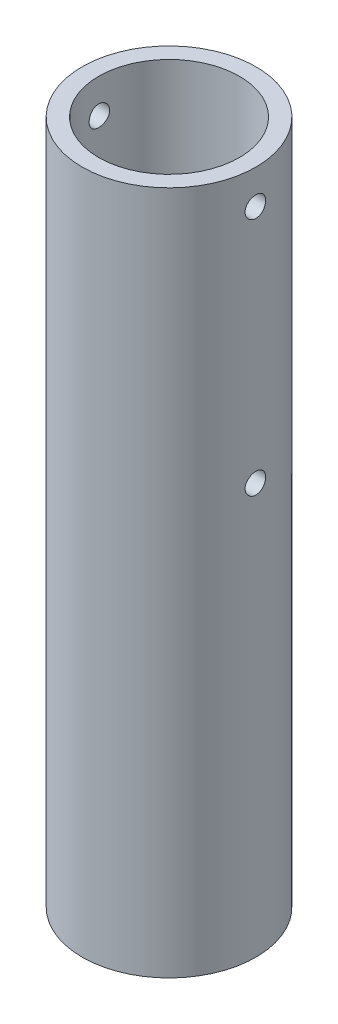
from build123d import *

# Parameters (mm, degrees)
SKETCH1_R               = 12.7
SKETCH1_R_2             = 10.287
BOSS_EXTRUDE1_DEPTH     = 100
CUT_EXTRUDE1_DEPTH      = 20
CUT_EXTRUDE1_DEPTH_BACK = 20
SKETCH2_R               = 1.5


with BuildPart() as part:
    # Sketch1 → Boss-Extrude1 (new body)
    with BuildSketch(Plane(origin=(0, 0, 0), x_dir=(1, 0, 0), z_dir=(0, 1, 0))):
        Circle(SKETCH1_R)
        Circle(SKETCH1_R_2, mode=Mode.SUBTRACT)
    extrude(amount=BOSS_EXTRUDE1_DEPTH)

    # Sketch2 → Cut-Extrude1 (cut, two sides: drawn at the far end of the back side and taken through both)
    with BuildSketch(Plane(origin=(0, 0, 0), x_dir=(0, 0, -1), z_dir=(1, 0, 0)).offset(-CUT_EXTRUDE1_DEPTH_BACK)):
        with Locations((0, 95)):
            Circle(SKETCH2_R)
        with Locations((0, 60)):
            Circle(SKETCH2_R)
    extrude(amount=CUT_EXTRUDE1_DEPTH + CUT_EXTRUDE1_DEPTH_BACK, mode=Mode.SUBTRACT)


solid = part.part
